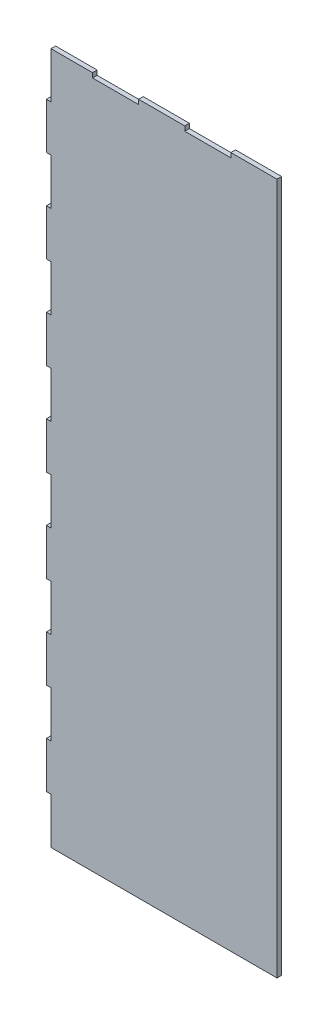
from build123d import *

# Parameters (mm, degrees)
BOSS_EXTRU_1_DEPTH = 5


with BuildPart() as part:
    # Esquisse1 → Boss.-Extru.1 (new body)
    with BuildSketch(Plane.XY):
        Polygon((0, 0), (0, 50), (-5, 50), (-5, 100), (0, 100), (0, 150), (-5, 150), (-5, 200), (0, 200), (0, 250), (-5, 250), (-5, 300), (0, 300), (0, 350), (-5, 350), (-5, 400), (0, 400), (0, 450), (-5, 450), (-5, 500), (0, 500), (0, 550), (-5, 550), (-5, 600), (0, 600), (0, 650), (-5, 650), (-5, 700), (0, 700), (0, 750), (45, 750), (45, 745), (95, 745), (95, 750), (145, 750), (145, 745), (195, 745), (195, 750), (245, 750), (245, 0), align=None)
    extrude(amount=BOSS_EXTRU_1_DEPTH)


solid = part.part
